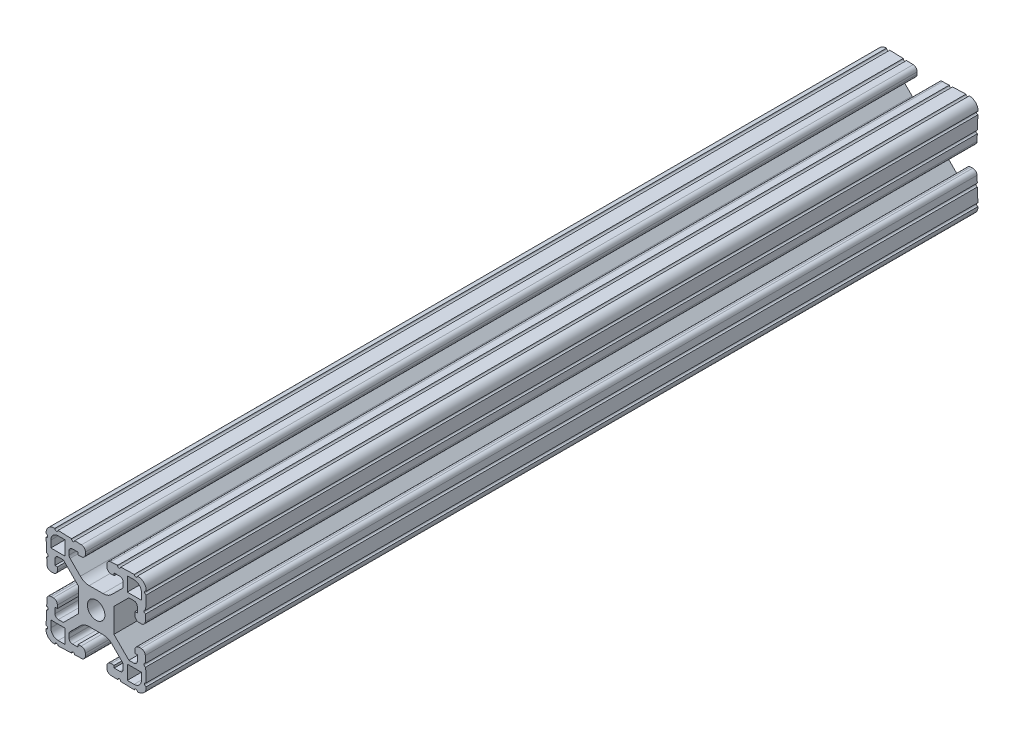
from build123d import *

# Parameters (mm, degrees)
SKETCH3_R      = 3.3274
EXTRUDE1_DEPTH = 158.033708189


with BuildPart() as part:
    # Sketch3 → Extrude1 (new, symmetric)
    with BuildSketch(Plane.XY):
        with BuildLine():
            Line((-2.633706952, 6.7564), (2.633706952, 6.7564))
            ThreePointArc((2.633706952, 6.7564), (4.451376719, 7.117956996), (5.992322742, 8.147584211))
            Line((5.992322742, 8.147584211), (9.915025612, 12.070287081))
            ThreePointArc((9.915025612, 12.070287081), (10.190327006, 12.482304734), (10.287, 12.968312693))
            Line((10.287, 12.968312693), (10.287, 14.374526586))
            ThreePointArc((10.287, 14.374526586), (9.915025612, 15.272552198), (9.017, 15.644526586))
            Line((9.017, 15.644526586), (6.858, 15.644526586))
            Line((6.858, 15.644526586), (6.858, 14.732540373))
            Line((6.858, 14.732540373), (5.721166713, 14.732540373))
            ThreePointArc((5.721166713, 14.732540373), (4.592195968, 15.154645238), (4.092366311, 16.25142132))
            Line((4.092366311, 16.25142132), (4.064, 17.063726184))
            ThreePointArc((4.064, 17.063726184), (4.486104865, 18.192696929), (5.582880947, 18.692526586))
            Line((5.582880947, 18.692526586), (8.126437228, 18.781349529))
            ThreePointArc((8.126437228, 18.781349529), (8.756940609, 18.193395614), (9.344894524, 18.823898995))
            Line((9.344894524, 18.823898995), (14.476437228, 19.003096415))
            ThreePointArc((14.476437228, 19.003096415), (15.106940609, 18.4151425), (15.694894524, 19.045645881))
            Line((15.694894524, 19.045645881), (15.764194098, 19.048065876))
            ThreePointArc((15.764194098, 19.048065876), (18.12006403, 18.12006403), (19.048065876, 15.764194098))
            Line((19.048065876, 15.764194098), (19.045645881, 15.694894524))
            ThreePointArc((19.045645881, 15.694894524), (18.4151425, 15.106940609), (19.003096415, 14.476437228))
            Line((19.003096415, 14.476437228), (18.823898995, 9.344894524))
            ThreePointArc((18.823898995, 9.344894524), (18.193395614, 8.756940609), (18.781349529, 8.126437228))
            Line((18.781349529, 8.126437228), (18.692526586, 5.582880947))
            ThreePointArc((18.692526586, 5.582880947), (18.192696929, 4.486104865), (17.063726184, 4.064))
            Line((17.063726184, 4.064), (16.25142132, 4.092366311))
            ThreePointArc((16.25142132, 4.092366311), (15.154645238, 4.592195968), (14.732540373, 5.721166713))
            Line((14.732540373, 5.721166713), (14.732540373, 6.858))
            Line((14.732540373, 6.858), (15.644526586, 6.858))
            Line((15.644526586, 6.858), (15.644526586, 9.017))
            ThreePointArc((15.644526586, 9.017), (15.272552198, 9.915025612), (14.374526586, 10.287))
            Line((14.374526586, 10.287), (12.442261469, 10.287))
            Line((12.442261469, 10.287), (6.7564, 4.601138531))
            Line((6.7564, 4.601138531), (6.7564, -4.601138531))
            Line((6.7564, -4.601138531), (12.442261469, -10.287))
            Line((12.442261469, -10.287), (14.374526586, -10.287))
            ThreePointArc((14.374526586, -10.287), (15.272552198, -9.915025612), (15.644526586, -9.017))
            Line((15.644526586, -9.017), (15.644526586, -6.858))
            Line((15.644526586, -6.858), (14.732540373, -6.858))
            Line((14.732540373, -6.858), (14.732540373, -5.721166713))
            ThreePointArc((14.732540373, -5.721166713), (15.154645238, -4.592195968), (16.25142132, -4.092366311))
            Line((16.25142132, -4.092366311), (17.063726184, -4.064))
            ThreePointArc((17.063726184, -4.064), (18.192696929, -4.486104865), (18.692526586, -5.582880947))
            Line((18.692526586, -5.582880947), (18.781349529, -8.126437228))
            ThreePointArc((18.781349529, -8.126437228), (18.193395614, -8.756940609), (18.823898995, -9.344894524))
            Line((18.823898995, -9.344894524), (19.003096415, -14.476437228))
            ThreePointArc((19.003096415, -14.476437228), (18.4151425, -15.106940609), (19.045645881, -15.694894524))
            Line((19.045645881, -15.694894524), (19.048065876, -15.764194098))
            ThreePointArc((19.048065876, -15.764194098), (18.12006403, -18.12006403), (15.764194098, -19.048065876))
            Line((15.764194098, -19.048065876), (15.694894524, -19.045645881))
            ThreePointArc((15.694894524, -19.045645881), (15.106940609, -18.4151425), (14.476437228, -19.003096415))
            Line((14.476437228, -19.003096415), (9.344894524, -18.823898995))
            ThreePointArc((9.344894524, -18.823898995), (8.756940609, -18.193395614), (8.126437228, -18.781349529))
            Line((8.126437228, -18.781349529), (5.582880947, -18.692526586))
            ThreePointArc((5.582880947, -18.692526586), (4.486104865, -18.192696929), (4.064, -17.063726184))
            Line((4.064, -17.063726184), (4.092366311, -16.25142132))
            ThreePointArc((4.092366311, -16.25142132), (4.592195968, -15.154645238), (5.721166713, -14.732540373))
            Line((5.721166713, -14.732540373), (6.858, -14.732540373))
            Line((6.858, -14.732540373), (6.858, -15.644526586))
            Line((6.858, -15.644526586), (9.017, -15.644526586))
            ThreePointArc((9.017, -15.644526586), (9.915025612, -15.272552198), (10.287, -14.374526586))
            Line((10.287, -14.374526586), (10.287, -12.968312693))
            ThreePointArc((10.287, -12.968312693), (10.190327006, -12.482304734), (9.915025612, -12.070287081))
            Line((9.915025612, -12.070287081), (5.992322742, -8.147584211))
            ThreePointArc((5.992322742, -8.147584211), (4.451376719, -7.117956996), (2.633706952, -6.7564))
            Line((2.633706952, -6.7564), (-2.633706952, -6.7564))
            ThreePointArc((-2.633706952, -6.7564), (-4.451376719, -7.117956996), (-5.992322742, -8.147584211))
            Line((-5.992322742, -8.147584211), (-9.915025612, -12.070287081))
            ThreePointArc((-9.915025612, -12.070287081), (-10.190327006, -12.482304734), (-10.287, -12.968312693))
            Line((-10.287, -12.968312693), (-10.287, -14.374526586))
            ThreePointArc((-10.287, -14.374526586), (-9.915025612, -15.272552198), (-9.017, -15.644526586))
            Line((-9.017, -15.644526586), (-6.858, -15.644526586))
            Line((-6.858, -15.644526586), (-6.858, -14.732540373))
            Line((-6.858, -14.732540373), (-5.721166713, -14.732540373))
            ThreePointArc((-5.721166713, -14.732540373), (-4.592195968, -15.154645238), (-4.092366311, -16.25142132))
            Line((-4.092366311, -16.25142132), (-4.064, -17.063726184))
            ThreePointArc((-4.064, -17.063726184), (-4.486104865, -18.192696929), (-5.582880947, -18.692526586))
            Line((-5.582880947, -18.692526586), (-8.126437228, -18.781349529))
            ThreePointArc((-8.126437228, -18.781349529), (-8.756940609, -18.193395614), (-9.344894524, -18.823898995))
            Line((-9.344894524, -18.823898995), (-14.476437228, -19.003096415))
            ThreePointArc((-14.476437228, -19.003096415), (-15.106940609, -18.4151425), (-15.694894524, -19.045645881))
            Line((-15.694894524, -19.045645881), (-15.764194098, -19.048065876))
            ThreePointArc((-15.764194098, -19.048065876), (-18.12006403, -18.12006403), (-19.048065876, -15.764194098))
            Line((-19.048065876, -15.764194098), (-19.045645881, -15.694894524))
            ThreePointArc((-19.045645881, -15.694894524), (-18.4151425, -15.106940609), (-19.003096415, -14.476437228))
            Line((-19.003096415, -14.476437228), (-18.823898995, -9.344894524))
            ThreePointArc((-18.823898995, -9.344894524), (-18.193395614, -8.756940609), (-18.781349529, -8.126437228))
            Line((-18.781349529, -8.126437228), (-18.692526586, -5.582880947))
            ThreePointArc((-18.692526586, -5.582880947), (-18.192696929, -4.486104865), (-17.063726184, -4.064))
            Line((-17.063726184, -4.064), (-16.25142132, -4.092366311))
            ThreePointArc((-16.25142132, -4.092366311), (-15.154645238, -4.592195968), (-14.732540373, -5.721166713))
            Line((-14.732540373, -5.721166713), (-14.732540373, -6.858))
            Line((-14.732540373, -6.858), (-15.644526586, -6.858))
            Line((-15.644526586, -6.858), (-15.644526586, -9.017))
            ThreePointArc((-15.644526586, -9.017), (-15.272552198, -9.915025612), (-14.374526586, -10.287))
            Line((-14.374526586, -10.287), (-12.442261469, -10.287))
            Line((-12.442261469, -10.287), (-6.7564, -4.601138531))
            Line((-6.7564, -4.601138531), (-6.7564, 4.601138531))
            Line((-6.7564, 4.601138531), (-12.442261469, 10.287))
            Line((-12.442261469, 10.287), (-14.374526586, 10.287))
            ThreePointArc((-14.374526586, 10.287), (-15.272552198, 9.915025612), (-15.644526586, 9.017))
            Line((-15.644526586, 9.017), (-15.644526586, 6.858))
            Line((-15.644526586, 6.858), (-14.732540373, 6.858))
            Line((-14.732540373, 6.858), (-14.732540373, 5.721166713))
            ThreePointArc((-14.732540373, 5.721166713), (-15.154645238, 4.592195968), (-16.25142132, 4.092366311))
            Line((-16.25142132, 4.092366311), (-17.063726184, 4.064))
            ThreePointArc((-17.063726184, 4.064), (-18.192696929, 4.486104865), (-18.692526586, 5.582880947))
            Line((-18.692526586, 5.582880947), (-18.781349529, 8.126437228))
            ThreePointArc((-18.781349529, 8.126437228), (-18.193395614, 8.756940609), (-18.823898995, 9.344894524))
            Line((-18.823898995, 9.344894524), (-19.003096415, 14.476437228))
            ThreePointArc((-19.003096415, 14.476437228), (-18.4151425, 15.106940609), (-19.045645881, 15.694894524))
            Line((-19.045645881, 15.694894524), (-19.048065876, 15.764194098))
            ThreePointArc((-19.048065876, 15.764194098), (-18.12006403, 18.12006403), (-15.764194098, 19.048065876))
            Line((-15.764194098, 19.048065876), (-15.694894524, 19.045645881))
            ThreePointArc((-15.694894524, 19.045645881), (-15.106940609, 18.4151425), (-14.476437228, 19.003096415))
            Line((-14.476437228, 19.003096415), (-9.344894524, 18.823898995))
            ThreePointArc((-9.344894524, 18.823898995), (-8.756940609, 18.193395614), (-8.126437228, 18.781349529))
            Line((-8.126437228, 18.781349529), (-5.582880947, 18.692526586))
            ThreePointArc((-5.582880947, 18.692526586), (-4.486104865, 18.192696929), (-4.064, 17.063726184))
            Line((-4.064, 17.063726184), (-4.092366311, 16.25142132))
            ThreePointArc((-4.092366311, 16.25142132), (-4.592195968, 15.154645238), (-5.721166713, 14.732540373))
            Line((-5.721166713, 14.732540373), (-6.858, 14.732540373))
            Line((-6.858, 14.732540373), (-6.858, 15.644526586))
            Line((-6.858, 15.644526586), (-9.017, 15.644526586))
            ThreePointArc((-9.017, 15.644526586), (-9.915025612, 15.272552198), (-10.287, 14.374526586))
            Line((-10.287, 14.374526586), (-10.287, 12.968312693))
            ThreePointArc((-10.287, 12.968312693), (-10.190327006, 12.482304734), (-9.915025612, 12.070287081))
            Line((-9.915025612, 12.070287081), (-5.992322742, 8.147584211))
            ThreePointArc((-5.992322742, 8.147584211), (-4.451376719, 7.117956996), (-2.633706952, 6.7564))
        make_face()
        with Locations(Location((0, 0, 0), (0, 0, 180))):
            Circle(SKETCH3_R, mode=Mode.SUBTRACT)
        with BuildLine():
            Line((-11.8364, 11.8364), (-11.8364, 17.2212))
            Line((-11.8364, 17.2212), (-14.4272, 17.2212))
            ThreePointArc((-14.4272, 17.2212), (-16.402856347, 16.402856347), (-17.2212, 14.4272))
            Line((-17.2212, 14.4272), (-17.2212, 11.8364))
            Line((-17.2212, 11.8364), (-11.8364, 11.8364))
        make_face(mode=Mode.SUBTRACT)
        with BuildLine():
            Line((11.8364, 17.2212), (14.4272, 17.2212))
            ThreePointArc((14.4272, 17.2212), (16.402856347, 16.402856347), (17.2212, 14.4272))
            Line((17.2212, 14.4272), (17.2212, 11.8364))
            Line((17.2212, 11.8364), (11.8364, 11.8364))
            Line((11.8364, 11.8364), (11.8364, 17.2212))
        make_face(mode=Mode.SUBTRACT)
        with BuildLine():
            Line((11.8364, -11.8364), (11.8364, -17.2212))
            Line((11.8364, -17.2212), (14.4272, -17.2212))
            ThreePointArc((14.4272, -17.2212), (16.402856347, -16.402856347), (17.2212, -14.4272))
            Line((17.2212, -14.4272), (17.2212, -11.8364))
            Line((17.2212, -11.8364), (11.8364, -11.8364))
        make_face(mode=Mode.SUBTRACT)
        with BuildLine():
            Line((-11.8364, -17.2212), (-14.4272, -17.2212))
            ThreePointArc((-14.4272, -17.2212), (-16.402856347, -16.402856347), (-17.2212, -14.4272))
            Line((-17.2212, -14.4272), (-17.2212, -11.8364))
            Line((-17.2212, -11.8364), (-11.8364, -11.8364))
            Line((-11.8364, -11.8364), (-11.8364, -17.2212))
        make_face(mode=Mode.SUBTRACT)
    extrude(amount=EXTRUDE1_DEPTH, both=True)


solid = part.part
